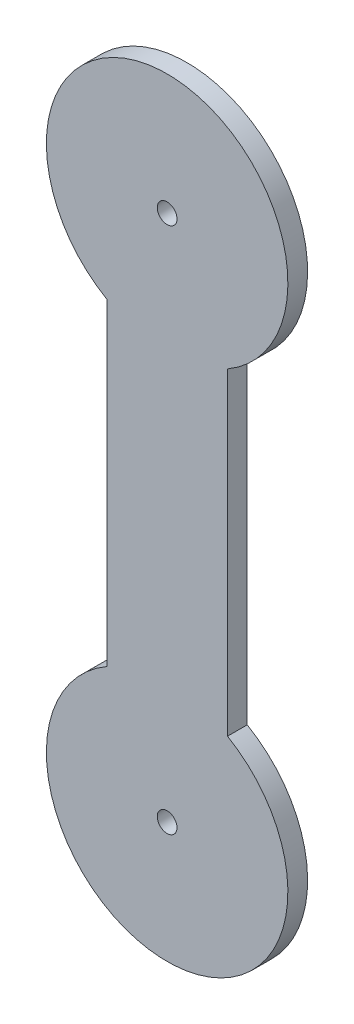
from build123d import *

# Parameters (mm, degrees)
BOSS_EXTRUDE1_DEPTH = 6.223


with BuildPart() as part:
    # Sketch1 → Boss-Extrude1 (new body)
    with BuildSketch(Plane.XY):
        with BuildLine():
            ThreePointArc((0, 133.374432116), (19.05, 128.27), (38.1, 133.374432116))
            Line((38.1, 133.374432116), (38.1, 166.37))
            Line((38.1, 166.37), (22.1615, 166.37))
            ThreePointArc((22.1615, 166.37), (19.05, 163.2585), (15.9385, 166.37))
            Line((15.9385, 166.37), (0, 166.37))
            Line((0, 166.37), (0, 133.374432116))
        make_face()
        with BuildLine():
            Line((38.1, 166.37), (38.1, 133.374432116))
            ThreePointArc((38.1, 133.374432116), (52.045567884, 147.32), (57.15, 166.37))
            ThreePointArc((57.15, 166.37), (0, 199.365567884), (0, 133.374432116))
            Line((0, 133.374432116), (0, 166.37))
            Line((0, 166.37), (15.9385, 166.37))
            ThreePointArc((15.9385, 166.37), (19.05, 169.4815), (22.1615, 166.37))
            Line((22.1615, 166.37), (38.1, 166.37))
        make_face()
        with BuildLine():
            ThreePointArc((0, 32.995567884), (19.05, 38.1), (38.1, 32.995567884))
            Line((38.1, 32.995567884), (38.1, 133.374432116))
            ThreePointArc((38.1, 133.374432116), (19.05, 128.27), (0, 133.374432116))
            Line((0, 133.374432116), (0, 32.995567884))
        make_face()
        with BuildLine():
            ThreePointArc((15.9385, 0), (19.05, 3.1115), (22.1615, 0))
            Line((22.1615, 0), (38.1, 0))
            Line((38.1, 0), (38.1, 32.995567884))
            ThreePointArc((38.1, 32.995567884), (19.05, 38.1), (0, 32.995567884))
            Line((0, 32.995567884), (0, 0))
            Line((0, 0), (15.9385, 0))
        make_face()
        with BuildLine():
            Line((38.1, 0), (22.1615, 0))
            ThreePointArc((22.1615, 0), (19.05, -3.1115), (15.9385, 0))
            Line((15.9385, 0), (0, 0))
            Line((0, 0), (0, 32.995567884))
            ThreePointArc((0, 32.995567884), (0, -32.995567884), (57.15, 0))
            ThreePointArc((57.15, 0), (52.045567884, 19.05), (38.1, 32.995567884))
            Line((38.1, 32.995567884), (38.1, 0))
        make_face()
    extrude(amount=BOSS_EXTRUDE1_DEPTH)


solid = part.part
